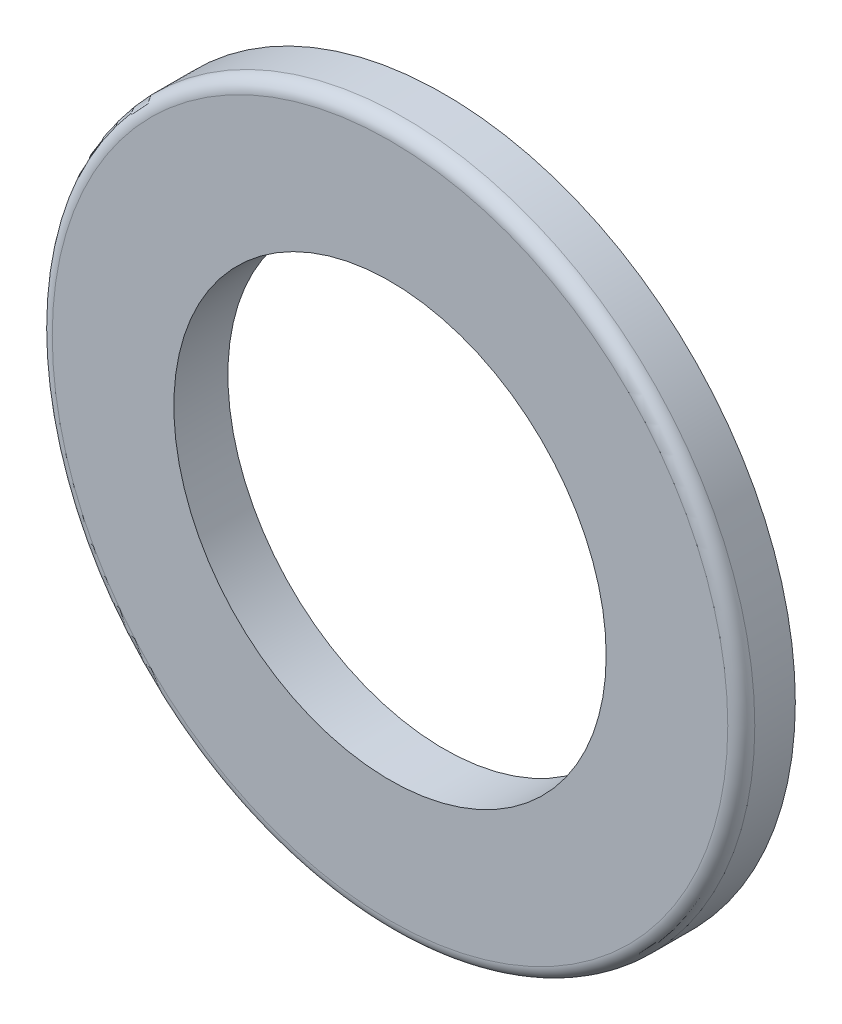
from build123d import *

# Parameters (mm, degrees)
SKETCH1_R           = 13
SKETCH1_R_2         = 8
BOSS_EXTRUDE1_DEPTH = 2
FILLET1_R           = 0.5


with BuildPart() as part:
    # Sketch1 → Boss-Extrude1 (new body)
    with BuildSketch(Plane.XY):
        Circle(SKETCH1_R)
        Circle(SKETCH1_R_2, mode=Mode.SUBTRACT)
    extrude(amount=BOSS_EXTRUDE1_DEPTH)

    # Fillet1
    fillet1_edges = [part.edges().sort_by_distance(p)[0] for p in [
        (-13, 0, 2),
    ]]
    fillet(fillet1_edges, radius=FILLET1_R)


solid = part.part
